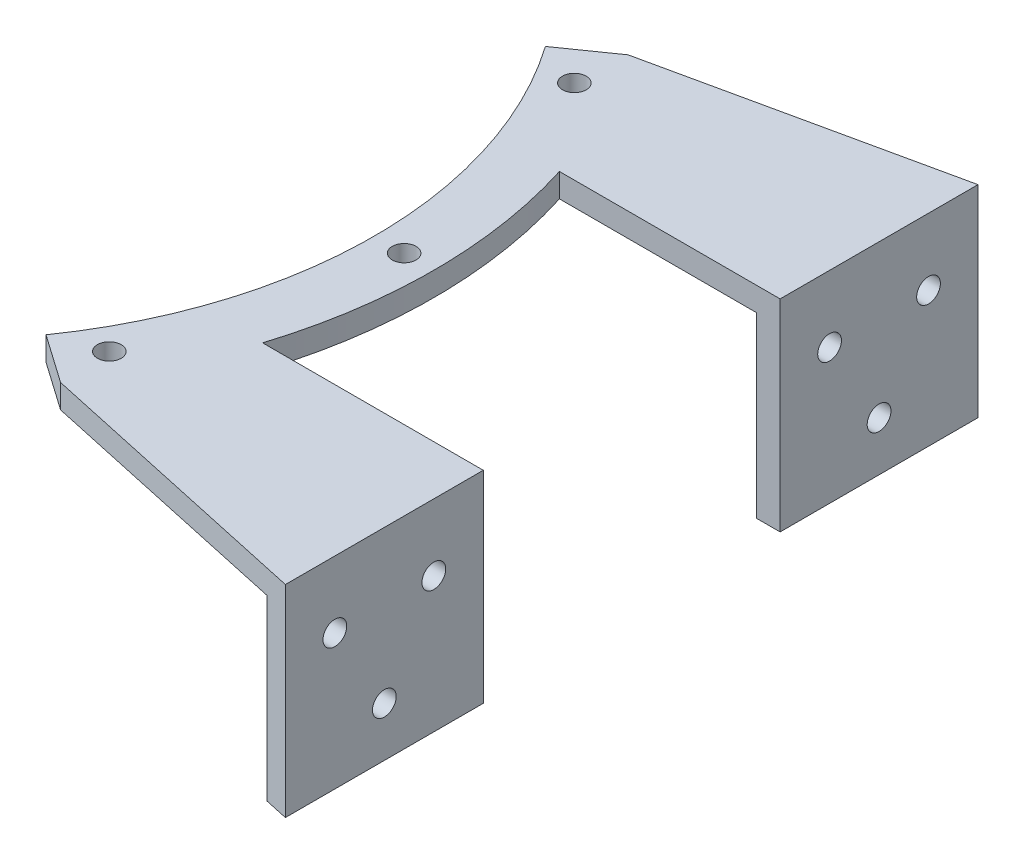
from build123d import *

# Parameters (mm, degrees)
SKETCH1_R           = 6
BOSS_EXTRUDE2_DEPTH = 12
BOSS_EXTRUDE3_DEPTH = 90
SKETCH4_R           = 6
CUT_EXTRUDE1_DEPTH  = 253.233216373


with BuildPart() as part:
    # Sketch1 → Boss-Extrude2 (new body)
    with BuildSketch(Plane(origin=(0, 0, 0), x_dir=(1, 0, 0), z_dir=(0, 1, 0))):
        with BuildLine():
            Line((350, 175), (350, 75))
            Line((350, 75), (238.484800354, 75))
            ThreePointArc((238.484800354, 75), (250, 0), (238.484800354, -75))
            Line((238.484800354, -75), (350, -75))
            Line((350, -75), (350, -175))
            Line((350, -175), (204.788011072, -143.394109088))
            Line((204.788011072, -143.394109088), (180.213449744, -126.186815997))
            ThreePointArc((180.213449744, -126.186815997), (220, 0), (180.213449744, 126.186815997))
            Line((180.213449744, 126.186815997), (204.788011072, 143.394109088))
            Line((204.788011072, 143.394109088), (350, 175))
        make_face()
        with Locations(Location((203.515969889, -117.5, 0), (0, 0, 270))):
            Circle(SKETCH1_R, mode=Mode.SUBTRACT)
        with Locations(Location((235, 0, 0), (0, 0, 270))):
            Circle(SKETCH1_R, mode=Mode.SUBTRACT)
        with Locations(Location((203.515969889, 117.5, 0), (0, 0, 270))):
            Circle(SKETCH1_R, mode=Mode.SUBTRACT)
    extrude(amount=BOSS_EXTRUDE2_DEPTH)

    # Sketch2 → Boss-Extrude3 (add)
    with BuildSketch(Plane(origin=(0, 0, 0), x_dir=(-1, 0, 0), z_dir=(0, -1, 0))):
        Polygon((-350, -175), (-350, -75), (-338, -75), (-338, -172.388158555), align=None)
        Polygon((-350, 75), (-350, 175), (-338, 172.388158555), (-338, 75), align=None)
    extrude(amount=BOSS_EXTRUDE3_DEPTH)

    # Sketch4 → Cut-Extrude1 (cut, through all)
    with BuildSketch(Plane.ZY.offset(-338)):
        with Locations((-150, -21.698729811)):
            Circle(SKETCH4_R)
        with Locations((-125, -65)):
            Circle(SKETCH4_R)
        with Locations((-100, -21.698729811)):
            Circle(SKETCH4_R)
        with Locations(Location((125, -65, 0), (0, 0, 180))):
            Circle(SKETCH4_R)
        with Locations(Location((150, -21.698729811, 0), (0, 0, 180))):
            Circle(SKETCH4_R)
        with Locations(Location((100, -21.698729811, 0), (0, 0, 180))):
            Circle(SKETCH4_R)
    extrude(amount=-CUT_EXTRUDE1_DEPTH, mode=Mode.SUBTRACT)


solid = part.part
